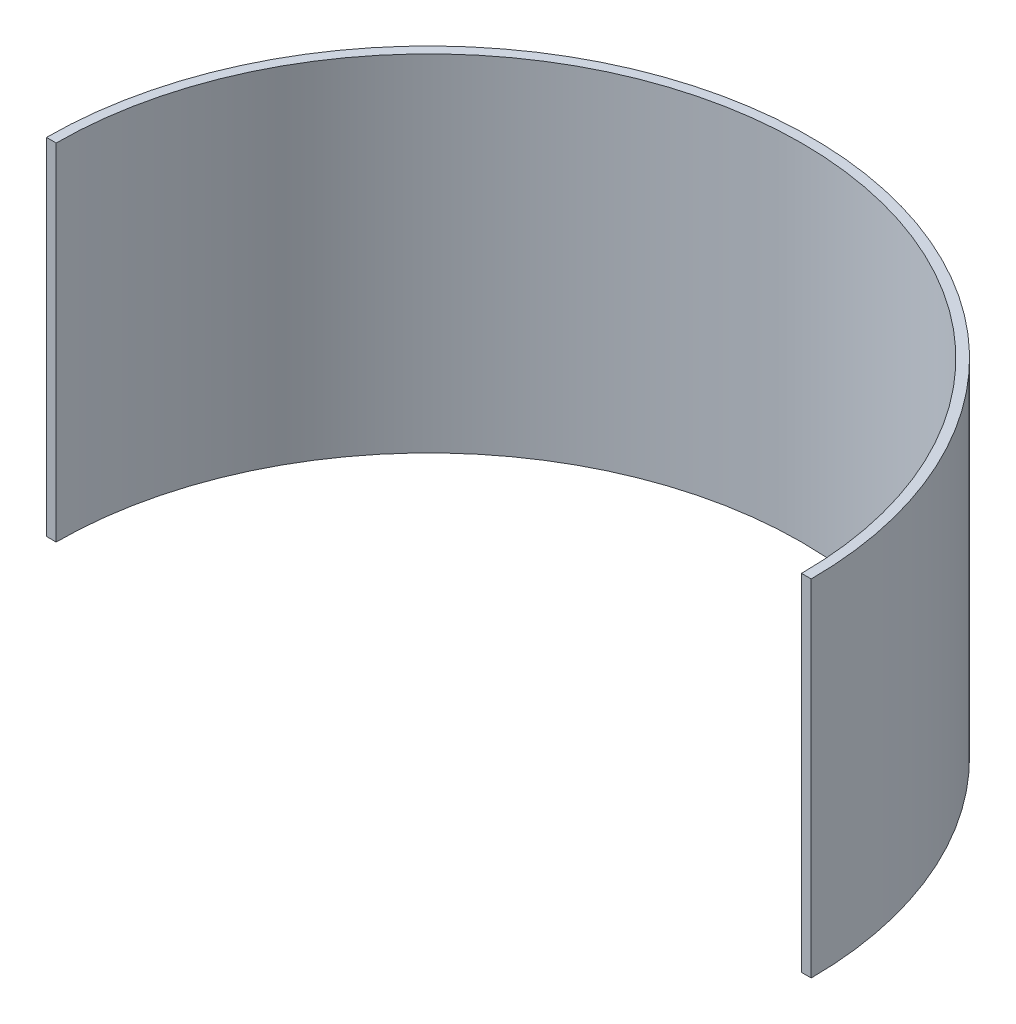
from build123d import *

# Parameters (mm, degrees)
BOSS_EXTRUDE1_DEPTH = 24.9


with BuildPart() as part:
    # Sketch1 → Boss-Extrude1 (new body)
    with BuildSketch(Plane(origin=(0, 0, 0), x_dir=(1, 0, 0), z_dir=(0, 1, 0))):
        with BuildLine():
            ThreePointArc((-26.852, 0), (0, 26.852), (26.852, 0))
            Line((26.852, 0), (27.55, 0))
            ThreePointArc((27.55, 0), (0, 27.55), (-27.55, 0))
            Line((-27.55, 0), (-26.852, 0))
        make_face()
    extrude(amount=BOSS_EXTRUDE1_DEPTH)


solid = part.part
